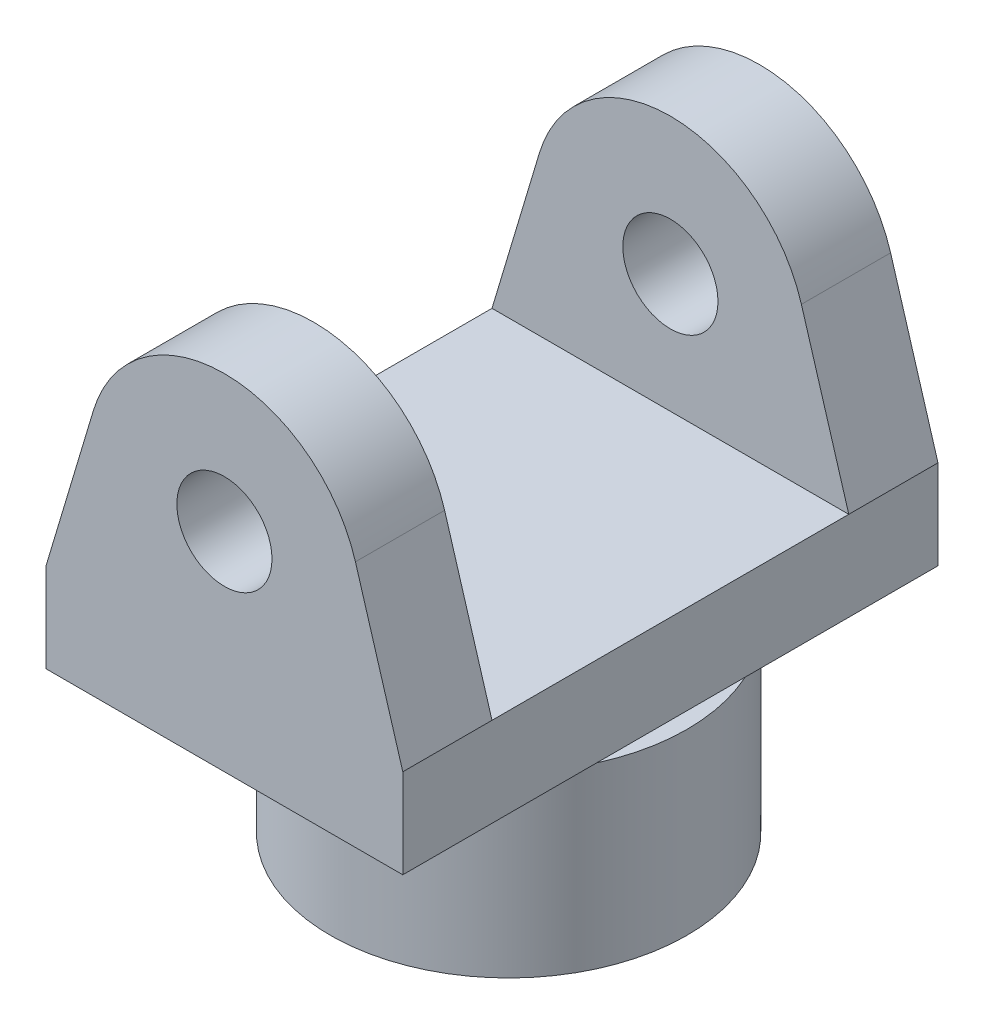
from build123d import *

# Parameters (mm, degrees)
SKETCH1_R           = 8
BOSS_EXTRUDE2_DEPTH = 15
SKETCH1_5_W         = 60
SKETCH1_5_H         = 15
BOSS_EXTRUDE3_DEPTH = 90
BOSS_EXTRUDE4_START = -15
SKETCH2_R           = 8
BOSS_EXTRUDE4_DEPTH = 15
SKETCH3_R           = 30
BOSS_EXTRUDE5_DEPTH = 30


with BuildPart() as part:
    # Sketch1 → Boss-Extrude2 (new body)
    with BuildSketch(Plane.XY):
        with BuildLine():
            Line((-22.03289839, 6.599347585), (-30, -20))
            Line((-30, -20), (30, -20))
            Line((30, -20), (22.03289839, 6.599347585))
            ThreePointArc((22.03289839, 6.599347585), (0, 23), (-22.03289839, 6.599347585))
        make_face()
        Circle(SKETCH1_R, mode=Mode.SUBTRACT)
    extrude(amount=BOSS_EXTRUDE2_DEPTH)

    # Sketch1<5> → Boss-Extrude3 (add)
    with BuildSketch(Plane.XY):
        with Locations((0, -27.5)):
            Rectangle(SKETCH1_5_W, SKETCH1_5_H)
    extrude(amount=BOSS_EXTRUDE3_DEPTH)

    # Sketch2 → Boss-Extrude4 (add)
    with BuildSketch(Plane.XY.offset(90).offset(BOSS_EXTRUDE4_START)):
        with BuildLine():
            Line((-22.03289839, 6.599347585), (-30, -20))
            Line((-30, -20), (30, -20))
            Line((30, -20), (22.03289839, 6.599347585))
            ThreePointArc((22.03289839, 6.599347585), (0, 23), (-22.03289839, 6.599347585))
        make_face()
        Circle(SKETCH2_R, mode=Mode.SUBTRACT)
    extrude(amount=BOSS_EXTRUDE4_DEPTH)

    # Sketch3 → Boss-Extrude5 (add)
    with BuildSketch(Plane.XZ.offset(35)):
        with Locations((2.720866767, 44.917667838)):
            Circle(SKETCH3_R)
        with BuildLine():
            Line((-2.279133233, 58.561813924), (-2.279133233, 64.417667838))
            Line((-2.279133233, 64.417667838), (7.720866767, 64.417667838))
            Line((7.720866767, 64.417667838), (7.720866767, 58.561813924))
            ThreePointArc((7.720866767, 58.561813924), (2.720866767, 30.386228736), (-2.279133233, 58.561813924))
        make_face(mode=Mode.SUBTRACT)
    extrude(amount=BOSS_EXTRUDE5_DEPTH)


solid = part.part
